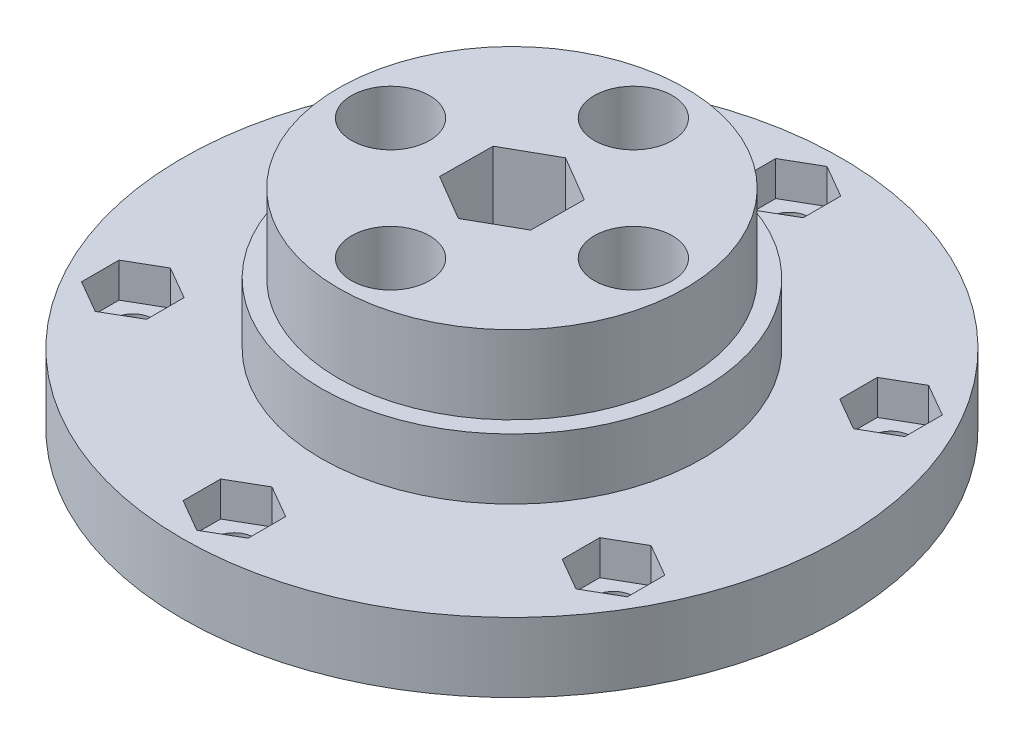
from build123d import *

# Parameters (mm, degrees)
SKETCH_1_R          = 38
EXTRUDE_1_DEPTH     = 8
SKETCH_2_R          = 20
EXTRUDE_2_DEPTH     = 16
SKETCH_7_R          = 22
EXTRUDE_3_DEPTH     = 7
SKETCH_3_R          = 4.5
SKETCH_3_R_2        = 3.25
CUT_EXTRUDE_1_DEPTH = 59.855755878
CUT_EXTRUDE_2_DEPTH = 12
SKETCH_5_R          = 2.25
CUT_EXTRUDE_3_DEPTH = 59.855755878
CUT_EXTRUDE_4_DEPTH = 4


with BuildPart() as part:
    # Эскиз1 → Бобышка-Вытянуть1 (new body)
    with BuildSketch(Plane(origin=(0, 0, 0), x_dir=(1, 0, 0), z_dir=(0, 1, 0))):
        with Locations(Location((0, 0, 0), (0, 0, 270))):
            Circle(SKETCH_1_R)
    extrude(amount=EXTRUDE_1_DEPTH)

    # Эскиз2 → Бобышка-Вытянуть2 (add)
    with BuildSketch(Plane(origin=(0, 8, 0), x_dir=(1, 0, 0), z_dir=(0, 1, 0))):
        with Locations(Location((0, 0, 0), (0, 0, 270))):
            Circle(SKETCH_2_R)
    extrude(amount=EXTRUDE_2_DEPTH)

    # Эскиз7 → Бобышка-Вытянуть3 (add)
    with BuildSketch(Plane(origin=(0, 8, 0), x_dir=(1, 0, 0), z_dir=(0, 1, 0))):
        with Locations(Location((0, 0, 0), (0, 0, 270))):
            Circle(SKETCH_7_R)
    extrude(amount=EXTRUDE_3_DEPTH)

    # Эскиз3 → Вырез-Вытянуть1 (cut, through all)
    with BuildSketch(Plane(origin=(0, 24, 0), x_dir=(1, 0, 0), z_dir=(0, 1, 0))):
        with Locations(Location((0, 14, 0), (0, 0, 270))):
            Circle(SKETCH_3_R)
        with Locations(Location((14, 0, 0), (0, 0, 270))):
            Circle(SKETCH_3_R)
        with Locations(Location((0, -14, 0), (0, 0, 270))):
            Circle(SKETCH_3_R)
        with Locations(Location((-14, 0, 0), (0, 0, 270))):
            Circle(SKETCH_3_R)
        with Locations(Location((0, 0, 0), (0, 0, 270))):
            Circle(SKETCH_3_R_2)
    extrude(amount=-CUT_EXTRUDE_1_DEPTH, mode=Mode.SUBTRACT)

    # Эскиз4 → Вырез-Вытянуть2 (cut)
    with BuildSketch(Plane(origin=(0, 24, 0), x_dir=(1, 0, 0), z_dir=(0, 1, 0))):
        Polygon((5.271310529, -3.109118628), (5.32823098, 3.010529515), (0.056920451, 6.119648143), (-5.271310529, 3.109118628), (-5.32823098, -3.010529515), (-0.056920451, -6.119648143), align=None)
    extrude(amount=-CUT_EXTRUDE_2_DEPTH, mode=Mode.SUBTRACT)

    # Эскиз5 → Вырез-Вытянуть3 (cut, through all)
    with BuildSketch(Plane(origin=(0, 24, 0), x_dir=(1, 0, 0), z_dir=(0, 1, 0))):
        with Locations(Location((0, 32, 0), (0, 0, 270))):
            Circle(SKETCH_5_R)
        with Locations(Location((27.712812921, 16, 0), (0, 0, 270))):
            Circle(SKETCH_5_R)
        with Locations(Location((27.712812921, -16, 0), (0, 0, 270))):
            Circle(SKETCH_5_R)
        with Locations(Location((0, -32, 0), (0, 0, 270))):
            Circle(SKETCH_5_R)
        with Locations(Location((-27.712812921, -16, 0), (0, 0, 270))):
            Circle(SKETCH_5_R)
        with Locations(Location((-27.712812921, 16, 0), (0, 0, 270))):
            Circle(SKETCH_5_R)
    extrude(amount=-CUT_EXTRUDE_3_DEPTH, mode=Mode.SUBTRACT)

    # Эскиз6 → Вырез-Вытянуть4 (cut)
    with BuildSketch(Plane(origin=(0, 8, 0), x_dir=(1, 0, 0), z_dir=(0, 1, 0))):
        Polygon((27.712812921, 11.669872981), (31.462812921, 13.834936491), (31.462812921, 18.165063509), (27.712812921, 20.330127019), (23.962812921, 18.165063509), (23.962812921, 13.834936491), align=None)
        Polygon((3.75, 29.834936491), (3.75, 34.165063509), (0, 36.330127019), (-3.75, 34.165063509), (-3.75, 29.834936491), (0, 27.669872981), align=None)
        Polygon((23.962812921, -18.165063509), (27.712812921, -20.330127019), (31.462812921, -18.165063509), (31.462812921, -13.834936491), (27.712812921, -11.669872981), (23.962812921, -13.834936491), align=None)
        Polygon((-3.75, -29.834936491), (-3.75, -34.165063509), (0, -36.330127019), (3.75, -34.165063509), (3.75, -29.834936491), (0, -27.669872981), align=None)
        Polygon((-27.712812921, -11.669872981), (-31.462812921, -13.834936491), (-31.462812921, -18.165063509), (-27.712812921, -20.330127019), (-23.962812921, -18.165063509), (-23.962812921, -13.834936491), align=None)
        Polygon((-23.962812921, 18.165063509), (-27.712812921, 20.330127019), (-31.462812921, 18.165063509), (-31.462812921, 13.834936491), (-27.712812921, 11.669872981), (-23.962812921, 13.834936491), align=None)
    extrude(amount=-CUT_EXTRUDE_4_DEPTH, mode=Mode.SUBTRACT)


solid = part.part
